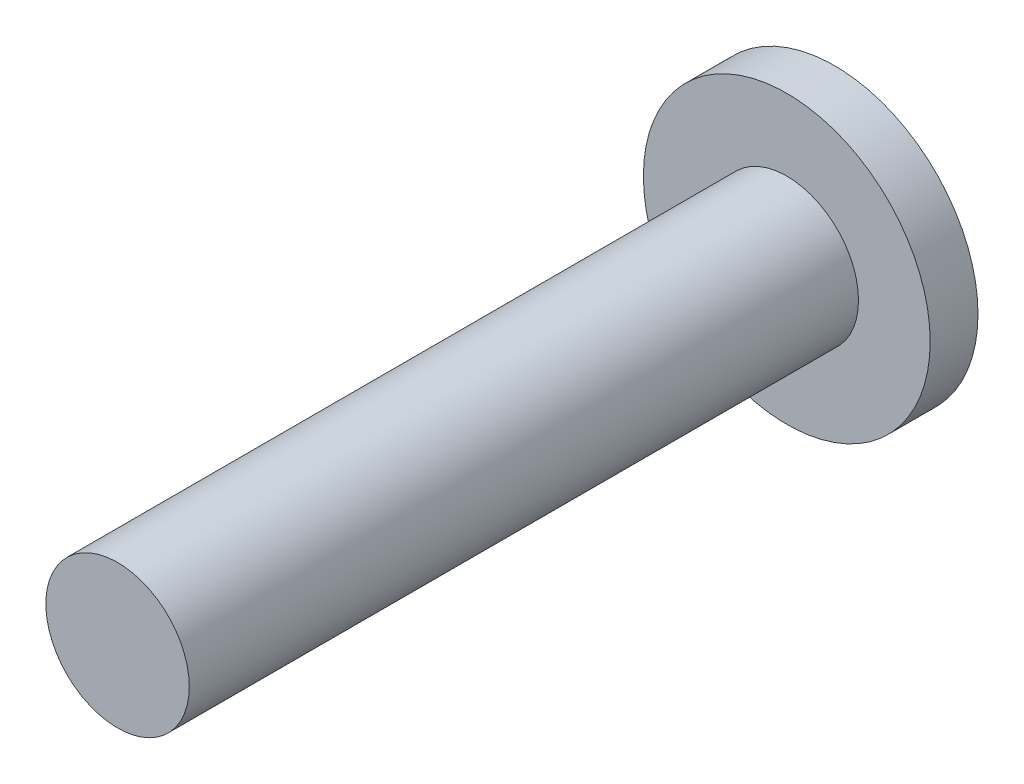
from build123d import *

# Parameters (mm, degrees)
SKETCH_1_R      = 3
EXTRUDE_1_DEPTH = 1
SKETCH_2_R      = 1.5
EXTRUDE_2_DEPTH = 14


with BuildPart() as part:
    # 草图1 → 凸台-拉伸1 (new body)
    with BuildSketch(Plane.XY):
        Circle(SKETCH_1_R)
    extrude(amount=EXTRUDE_1_DEPTH)

    # 草图2 → 凸台-拉伸2 (add)
    with BuildSketch(Plane.XY.offset(1)):
        Circle(SKETCH_2_R)
    extrude(amount=EXTRUDE_2_DEPTH)


solid = part.part
